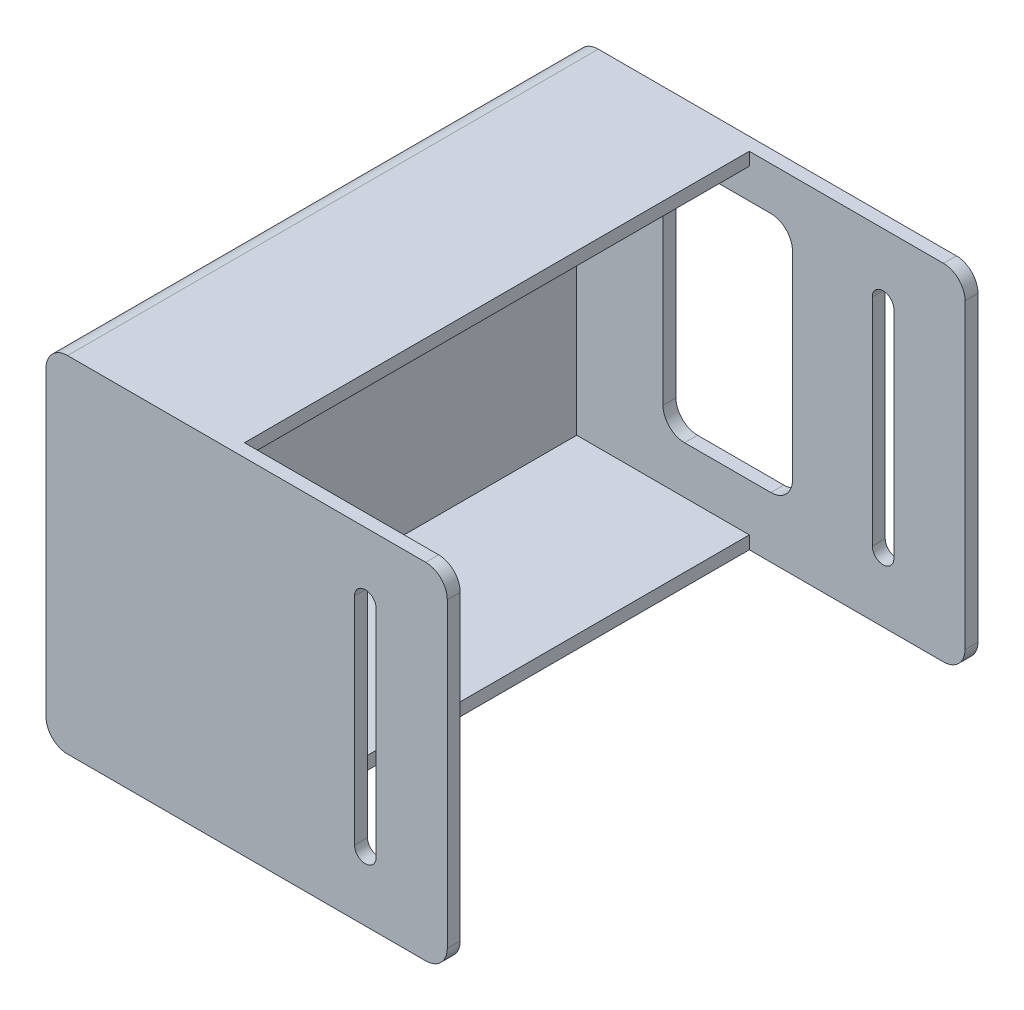
from build123d import *

# Parameters (mm, degrees)
SKETCH_1_W          = 123
SKETCH_1_H          = 80
EXTRUDE_1_DEPTH     = 93
SHELL_1_T           = -3
SKETCH_2_W          = 50
SKETCH_2_H          = 117
CUT_EXTRUDE_1_DEPTH = 138.227001716
FILLET_1_R          = 5
FILLET_2_R          = 5
CUT_EXTRUDE_2_REACH = 161.305
CUT_EXTRUDE_4_REACH = 161.305
SKETCH_5_W          = 30
SKETCH_5_H          = 56
CUT_EXTRUDE_5_REACH = 120.454
SKETCH_6_R          = 10
FILLET_3_R          = 5
CUT_EXTRUDE_6_REACH = 120.454
SKETCH_7_W          = 5
SKETCH_7_H          = 28


with BuildPart() as part:
    # 草圖1 → 填料-伸長1 (new body)
    with BuildSketch(Plane(origin=(0, 0, 0), x_dir=(0, 0, -1), z_dir=(1, 0, 0))):
        Rectangle(SKETCH_1_W, SKETCH_1_H)
    extrude(amount=EXTRUDE_1_DEPTH)

    # 薄殼1
    shell_1_openings = [part.faces().sort_by_distance(p)[0] for p in [
        (93, 0, 0),
    ]]
    offset(amount=SHELL_1_T, openings=shell_1_openings, kind=Kind.INTERSECTION)

    # 草圖2 → 除料-伸長1 (cut, through all)
    with BuildSketch(Plane(origin=(0, 40, 0), x_dir=(1, 0, 0), z_dir=(0, 1, 0))):
        with Locations((68, 0)):
            Rectangle(SKETCH_2_W, SKETCH_2_H)
    extrude(amount=-CUT_EXTRUDE_1_DEPTH, mode=Mode.SUBTRACT)

    # 圓角1
    fillet_1_edges = [part.edges().sort_by_distance(p)[0] for p in [
        (0, -40, 0),
        (0, 40, 0),
    ]]
    fillet(fillet_1_edges, radius=FILLET_1_R)

    # 圓角2
    fillet_2_edges = [part.edges().sort_by_distance(p)[0] for p in [
        (93, -40, 60),
        (93, -40, -60),
        (93, 40, 60),
        (93, 40, -60),
    ]]
    fillet(fillet_2_edges, radius=FILLET_2_R)

    # 草圖3 → 除料-伸長2 (cut, up to next)
    with BuildSketch(Plane(origin=(0, 0, -61.5), x_dir=(-1, 0, 0), z_dir=(0, 0, -1)), mode=Mode.PRIVATE) as cut_extrude_2_sk1:
        with BuildLine():
            Line((-76.5, -25), (-76.5, 25))
            ThreePointArc((-76.5, 25), (-74, 27.5), (-71.5, 25))
            Line((-71.5, 25), (-71.5, -25))
            ThreePointArc((-71.5, -25), (-74, -27.5), (-76.5, -25))
        make_face()
    cut_extrude_2_tool1 = extrude(cut_extrude_2_sk1.sketch, amount=-CUT_EXTRUDE_2_REACH, mode=Mode.PRIVATE) & part.part
    cut_extrude_2 = cut_extrude_2_tool1.solids().sort_by_distance((74, 0, -61.5))[0]
    add(cut_extrude_2, mode=Mode.SUBTRACT)

    # 鏡射1: 除料-伸長2 across plane
    add(cut_extrude_2.mirror(Plane.XY), mode=Mode.SUBTRACT)

    # 草圖5 → 除料-伸長4 (cut, up to next)
    with BuildSketch(Plane(origin=(0, 0, -61.5), x_dir=(-1, 0, 0), z_dir=(0, 0, -1)), mode=Mode.PRIVATE) as cut_extrude_4_sk1:
        with Locations((-38, 2)):
            Rectangle(SKETCH_5_W, SKETCH_5_H)
    cut_extrude_4_tool1 = extrude(cut_extrude_4_sk1.sketch, amount=-CUT_EXTRUDE_4_REACH, mode=Mode.PRIVATE) & part.part
    add(cut_extrude_4_tool1.solids().sort_by_distance((38, 2, -61.5))[0], mode=Mode.SUBTRACT)

    # 草圖6 → 除料-伸長5 (cut, up to next)
    with BuildSketch(Plane.ZY, mode=Mode.PRIVATE) as cut_extrude_5_sk1:
        with Locations((41.5, 20)):
            Circle(SKETCH_6_R)
    cut_extrude_5_tool1 = extrude(cut_extrude_5_sk1.sketch, amount=-CUT_EXTRUDE_5_REACH, mode=Mode.PRIVATE) & part.part
    add(cut_extrude_5_tool1.solids().sort_by_distance((0, 20, 41.5))[0], mode=Mode.SUBTRACT)

    # 圓角3
    fillet_3_edges = [part.edges().sort_by_distance(p)[0] for p in [
        (23, -26, -60),
        (23, 30, -60),
        (53, 30, -60),
        (53, -26, -60),
    ]]
    fillet(fillet_3_edges, radius=FILLET_3_R)

    # 草圖7 → 除料-伸長6 (cut, up to next)
    with BuildSketch(Plane.ZY, mode=Mode.PRIVATE) as cut_extrude_6_sk1:
        with Locations((1, 18)):
            Rectangle(SKETCH_7_W, SKETCH_7_H)
    cut_extrude_6_tool1 = extrude(cut_extrude_6_sk1.sketch, amount=-CUT_EXTRUDE_6_REACH, mode=Mode.PRIVATE) & part.part
    add(cut_extrude_6_tool1.solids().sort_by_distance((0, 18, 1))[0], mode=Mode.SUBTRACT)


solid = part.part
